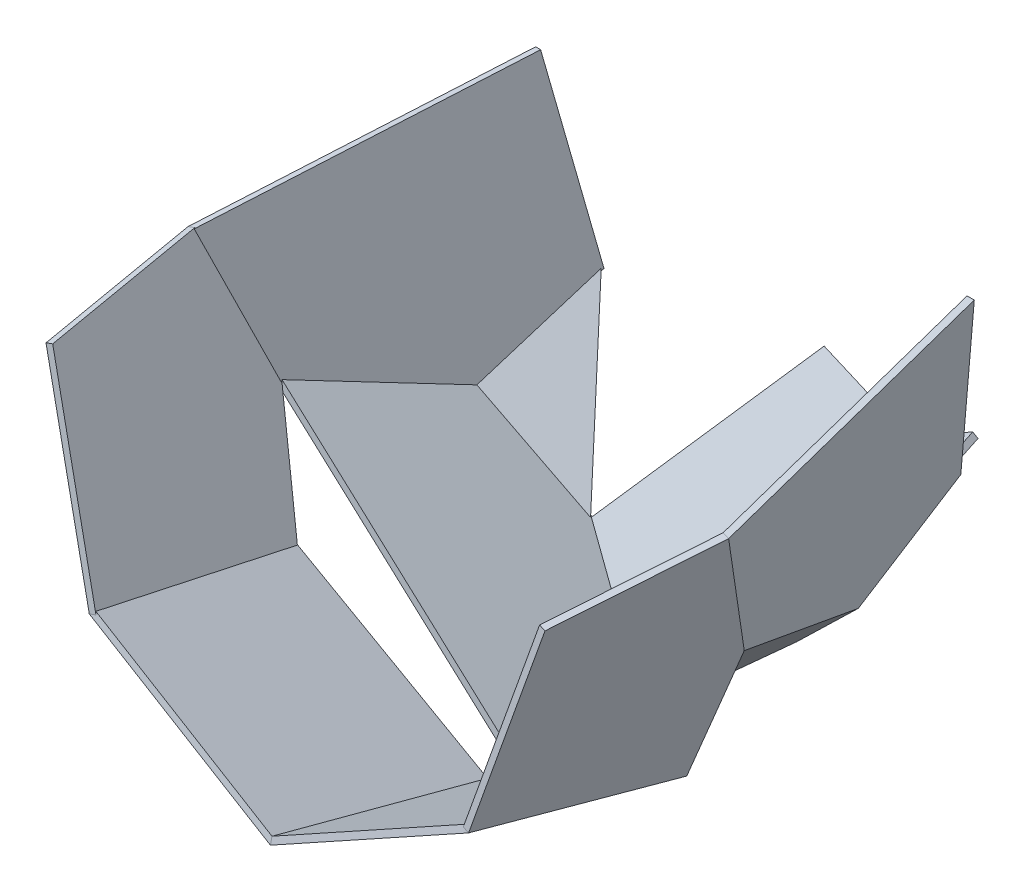
from build123d import *

# Parameters (mm, degrees)
BOSS_EXTRUDE1_DEPTH  = 2
BOSS_EXTRUDE2_DEPTH  = 2
BOSS_EXTRUDE3_DEPTH  = 2
BOSS_EXTRUDE4_DEPTH  = 2
BOSS_EXTRUDE5_DEPTH  = 2
BOSS_EXTRUDE11_DEPTH = 2


with BuildPart() as part:
    # Sketch3 → Boss-Extrude1 (new body)
    with BuildSketch(Plane(origin=(-0.346555838, -0.635169439, 0.169748229), x_dir=(0.8846275482433851, -0.4504883576630665, 0.12039244369531933), z_dir=(0.4662982960390243, 0.8546340716593914, -0.22839987449644675))):
        Polygon((-67.388202535, -86.290405408), (0.391753387, -80.63091609), (0.391753387, -10.098482667), (-70.319042991, -17.961416408), align=None)
    extrude(amount=BOSS_EXTRUDE1_DEPTH)



with BuildPart() as body_2:
    # Sketch5 → Boss-Extrude2 (new body)
    with BuildSketch(Plane(origin=(-56.35451769, -10.362612727, -10.830227939), x_dir=(0.18266051002357656, 0.033588081371868986, -0.9826021467856071), z_dir=(0.9663996352281745, 0.17770403455896827, 0.18572296877962188))):
        Polygon((-30.056447866, 130.475360148), (-13.538590304, 84.746354353), (36.390477752, 63.245242789), (73.411523815, 78.746769275), (65.375780796, 137.774420808), align=None)
    extrude(amount=BOSS_EXTRUDE2_DEPTH)


with BuildPart() as part_1:
    add(part.part)

    add(body_2.part)  # Boss-Extrude3 merges body 2
    # Sketch4 → Boss-Extrude3 (add)
    with BuildSketch(Plane(origin=(-48.24629982, -14.226608827, 5.383644926), x_dir=(0.10207726427725161, 0.030099993458726118, 0.994320985653756), z_dir=(-0.9537215923741782, -0.28122828227388286, 0.10642263616610528))):
        Polygon((65.177713076, 131.796906654), (70.437801909, 66.837017039), (3.69362899, 51.915356778), (-2.927449999, 90.54331453), (13.395731887, 136.34217175), align=None)
    extrude(amount=-BOSS_EXTRUDE3_DEPTH)

    # Sketch6 → Boss-Extrude4 (add)
    with BuildSketch(Plane(origin=(1.480799375, 1.587783801, -0.237470014), x_dir=(-0.7350655060210773, 0.6705381368478288, -0.10028613508666168), z_dir=(-0.6779960928043596, -0.7269797866087502, 0.10872758621582002))):
        Polygon((102.895181545, -13.174165852), (85.198045027, 38.226427476), (46.892200114, 50.954167672), (2.014513485, 39.25021901), (2.014513485, -1.928751345), align=None)
    extrude(amount=-BOSS_EXTRUDE4_DEPTH)

    # Sketch7 → Boss-Extrude5 (add)
    with BuildSketch(Plane(origin=(-19.399997247, -16.733859342, -9.71050635), x_dir=(0.26837311265933295, 0.23149064719993817, -0.9350871363998624), z_dir=(0.7080687682639505, 0.610759013089178, 0.3544178992933416))):
        Polygon((78.334992527, 90.006984524), (39.437055345, 80.117286778), (48.790397505, 40.850912927), align=None)
    extrude(amount=BOSS_EXTRUDE5_DEPTH)


with BuildPart() as body_2_2:
    # Sketch9 → Boss-Extrude11 (new body)
    with BuildSketch(Plane(origin=(-7.391063933, -10.877406216, -4.023277357), x_dir=(-0.8433068557681762, 0.5040578599076407, 0.1864382495083074), z_dir=(-0.5374323650603791, -0.7909375701930272, -0.29254779616800664))):
        Polygon((20.364698966, 128.780172412), (30.353097834, 60.7415241), (-8.7643826, 35.825426976), (-8.764379517, 126.585724452), align=None)
    extrude(amount=-BOSS_EXTRUDE11_DEPTH)


with BuildPart() as body_3:
    # Mirror1: mirrored copy
    add(part_1.part.mirror(Plane(origin=(0, 0, 0), x_dir=(0, 0, 1), z_dir=(1, 0, 0))))


with BuildPart() as body_4:
    # Mirror1 2: mirrored copy
    add(body_2_2.part.mirror(Plane(origin=(0, 0, 0), x_dir=(0, 0, 1), z_dir=(1, 0, 0))))


solid = Compound([part_1.part, body_2_2.part, body_3.part, body_4.part])
